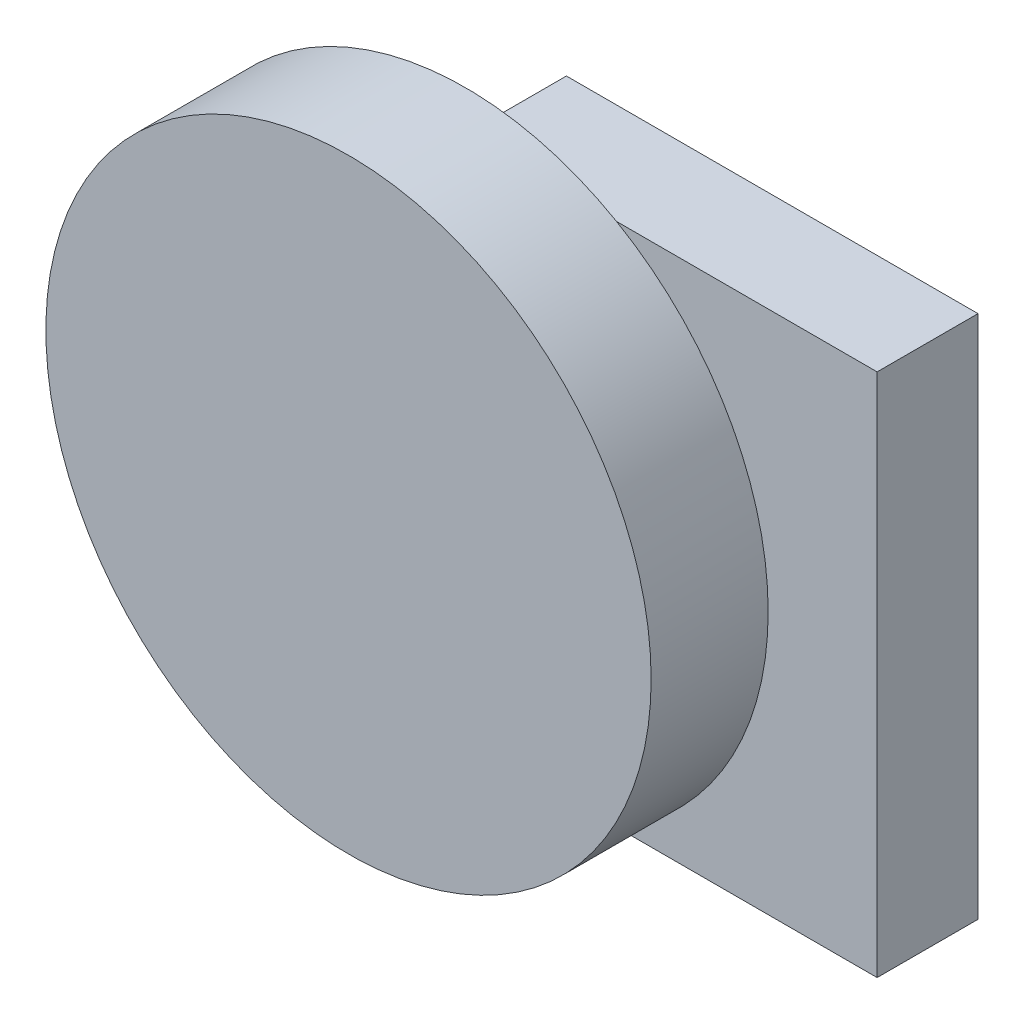
from build123d import *

# Parameters (mm, degrees)
SKETCH_1_W      = 10.2
SKETCH_1_H      = 13
EXTRUDE_1_DEPTH = 2.5
SKETCH_2_R      = 7.5
EXTRUDE_2_DEPTH = 2.9


with BuildPart() as part:
    # 草图1 → 凸台-拉伸1 (new body)
    with BuildSketch(Plane.XY):
        with Locations((-5.1, 6.5)):
            Rectangle(SKETCH_1_W, SKETCH_1_H)
    extrude(amount=EXTRUDE_1_DEPTH)

    # 草图2 → 凸台-拉伸2 (add)
    with BuildSketch(Plane.XY.offset(2.5)):
        with Locations(Location((-10.2, 6.5, 0), (0, 0, 299.926434867))):
            Circle(SKETCH_2_R)
    extrude(amount=EXTRUDE_2_DEPTH)


solid = part.part
